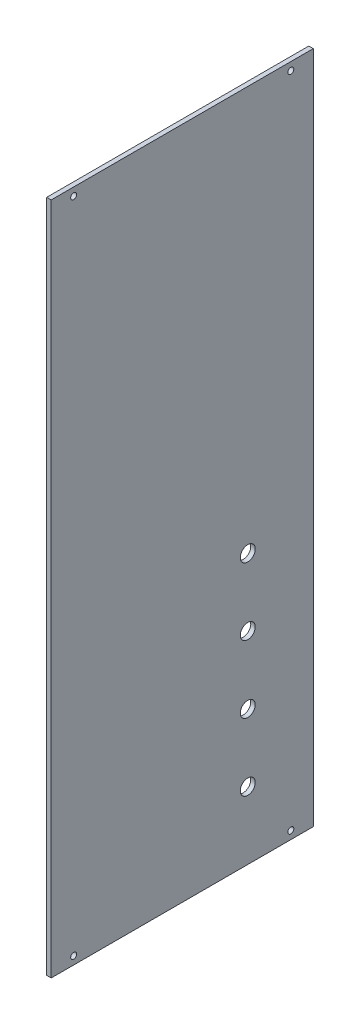
from build123d import *

# Parameters (mm, degrees)
SKETCH1_W           = 175
SKETCH1_H           = 450
SKETCH1_R           = 2
BOSS_EXTRUDE1_DEPTH = 3
SKETCH2_R           = 5
RCA_HOLES_DEPTH     = 242.433738322


with BuildPart() as part:
    # Sketch1 → Boss-Extrude1 (new body)
    with BuildSketch(Plane(origin=(0, 0, 0), x_dir=(0, 0, -1), z_dir=(1, 0, 0))):
        Rectangle(SKETCH1_W, SKETCH1_H)
        with Locations((-72.5, 219.66814109)):
            Circle(SKETCH1_R, mode=Mode.SUBTRACT)
        with Locations((72.5, 219.66814109)):
            Circle(SKETCH1_R, mode=Mode.SUBTRACT)
        with Locations((72.5, -219.66814109)):
            Circle(SKETCH1_R, mode=Mode.SUBTRACT)
        with Locations((-72.5, -219.66814109)):
            Circle(SKETCH1_R, mode=Mode.SUBTRACT)
    extrude(amount=BOSS_EXTRUDE1_DEPTH)

    # Sketch2 → RCA_Holes (cut, through all)
    with BuildSketch(Plane(origin=(0, 0, 0), x_dir=(0, 0, -1), z_dir=(1, 0, 0))):
        with Locations((43.75, -90)):
            Circle(SKETCH2_R)
        with Locations((43.75, -45)):
            Circle(SKETCH2_R)
        with Locations(Location((43.75, -135, 0), (0, 0, 180))):
            Circle(SKETCH2_R)
        with Locations(Location((43.75, -180, 0), (0, 0, 180))):
            Circle(SKETCH2_R)
    extrude(amount=RCA_HOLES_DEPTH, mode=Mode.SUBTRACT)


solid = part.part
